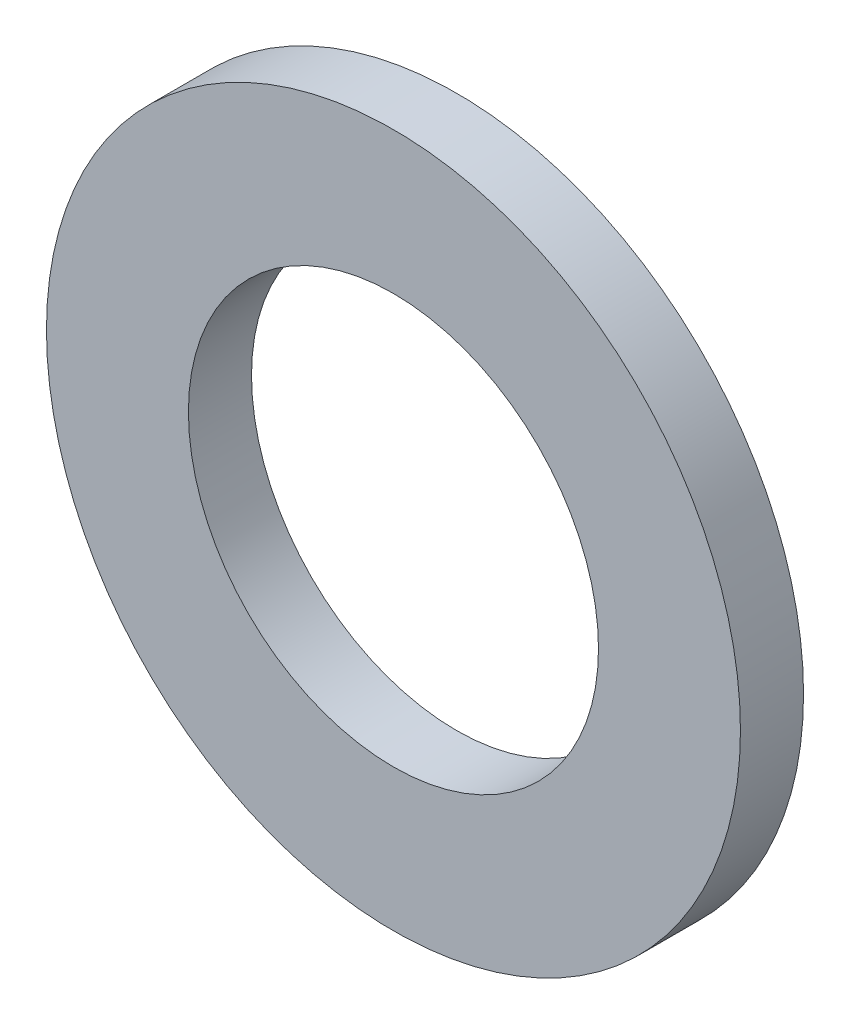
from build123d import *

# Parameters (mm, degrees)
ESQUISSE1_R        = 22
ESQUISSE1_R_2      = 13
BOSS_EXTRU_1_DEPTH = 4


with BuildPart() as part:
    # Esquisse1 → Boss.-Extru.1 (new body)
    with BuildSketch(Plane.XY):
        Circle(ESQUISSE1_R)
        Circle(ESQUISSE1_R_2, mode=Mode.SUBTRACT)
    extrude(amount=BOSS_EXTRU_1_DEPTH)


solid = part.part
